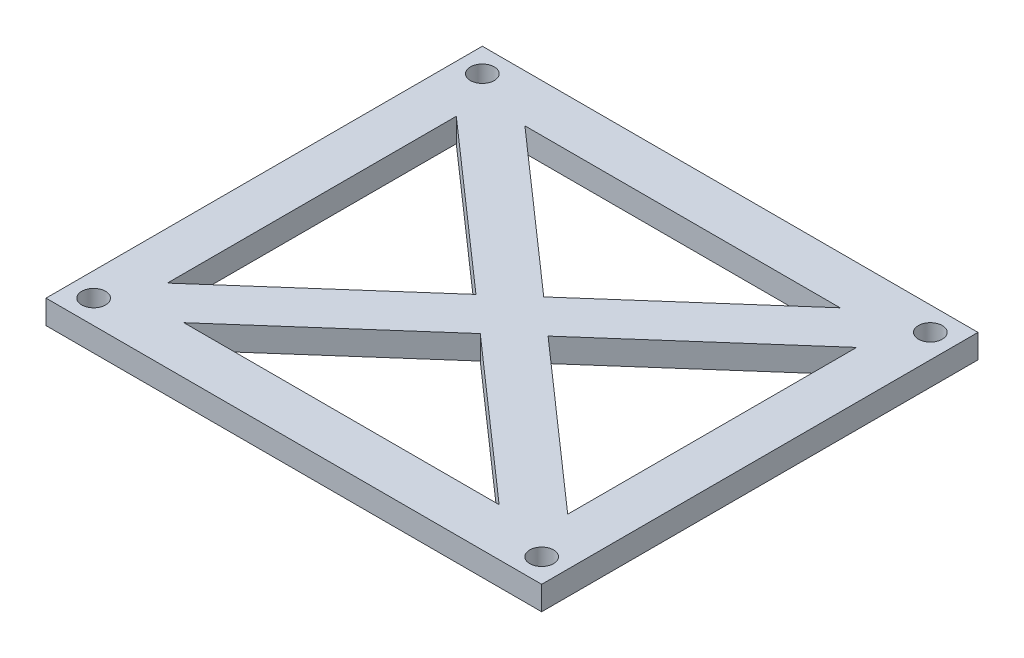
from build123d import *

# Parameters (mm, degrees)
SKETCH1_W           = 66.04
SKETCH1_H           = 58.135485311
SKETCH1_R           = 1.5875
BOSS_EXTRUDE1_DEPTH = 3.175


with BuildPart() as part:
    # Sketch1 → Boss-Extrude1 (new body)
    with BuildSketch(Plane(origin=(0, 0, 0), x_dir=(1, 0, 0), z_dir=(0, 1, 0))):
        with Locations((0, -4.325528995)):
            Rectangle(SKETCH1_W, SKETCH1_H)
        with Locations(Location((29.845, 21.56721366, 0), (0, 0, 90))):
            Circle(SKETCH1_R, mode=Mode.SUBTRACT)
        with Locations(Location((29.845, -30.218271651, 0), (0, 0, 270))):
            Circle(SKETCH1_R, mode=Mode.SUBTRACT)
        with Locations(Location((-29.845, -30.218271651, 0), (0, 0, 90))):
            Circle(SKETCH1_R, mode=Mode.SUBTRACT)
        with Locations(Location((-29.845, 21.56721366, 0), (0, 0, 270))):
            Circle(SKETCH1_R, mode=Mode.SUBTRACT)
        Polygon((-26.67, -23.573367042), (-4.805088789, -4.325528996), (-26.67, 14.92230905), align=None, mode=Mode.SUBTRACT)
        Polygon((-21.00151998, 18.39221366), (0, -0.095574897), (21.00151998, 18.39221366), align=None, mode=Mode.SUBTRACT)
        Polygon((0, -8.555483095), (21.00151998, -27.043271651), (-21.00151998, -27.043271651), align=None, mode=Mode.SUBTRACT)
        Polygon((4.805088789, -4.325528996), (26.67, 14.92230905), (26.67, -23.573367042), align=None, mode=Mode.SUBTRACT)
    extrude(amount=BOSS_EXTRUDE1_DEPTH)


solid = part.part
